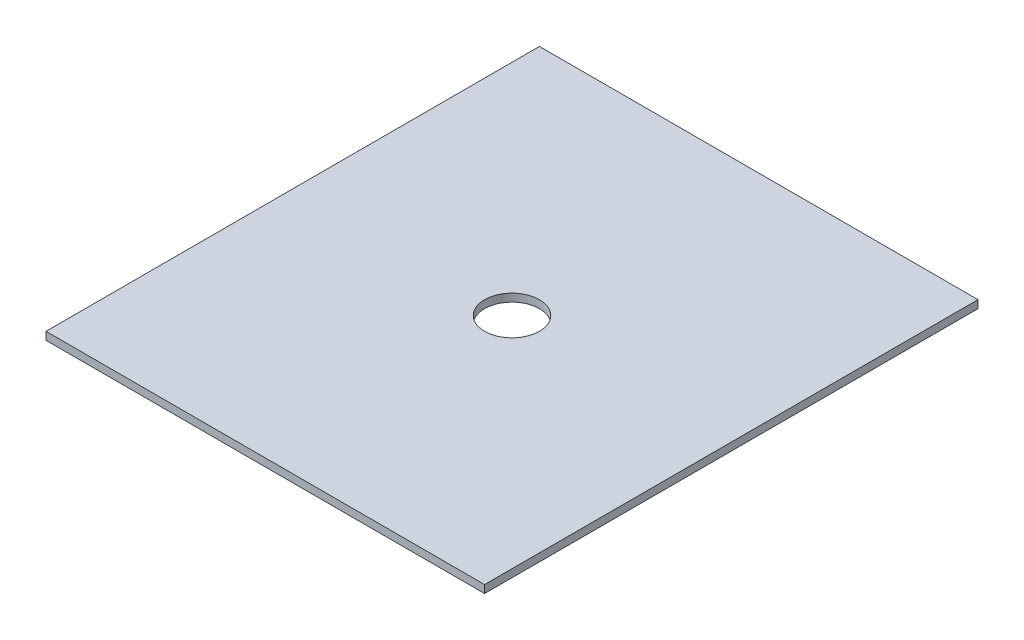
from build123d import *

# Parameters (mm, degrees)
SKETCH1_W           = 355.6
SKETCH1_H           = 400.05
SKETCH1_R           = 22.225
BOSS_EXTRUDE1_DEPTH = 6.35


with BuildPart() as part:
    # Sketch1 → Boss-Extrude1 (new body)
    with BuildSketch(Plane(origin=(0, 0, 0), x_dir=(1, 0, 0), z_dir=(0, 1, 0))):
        with Locations((177.8, 200.025)):
            Rectangle(SKETCH1_W, SKETCH1_H)
        with Locations(Location((177.8, 200.025, 0), (0, 0, 270))):
            Circle(SKETCH1_R, mode=Mode.SUBTRACT)
    extrude(amount=BOSS_EXTRUDE1_DEPTH)


solid = part.part
